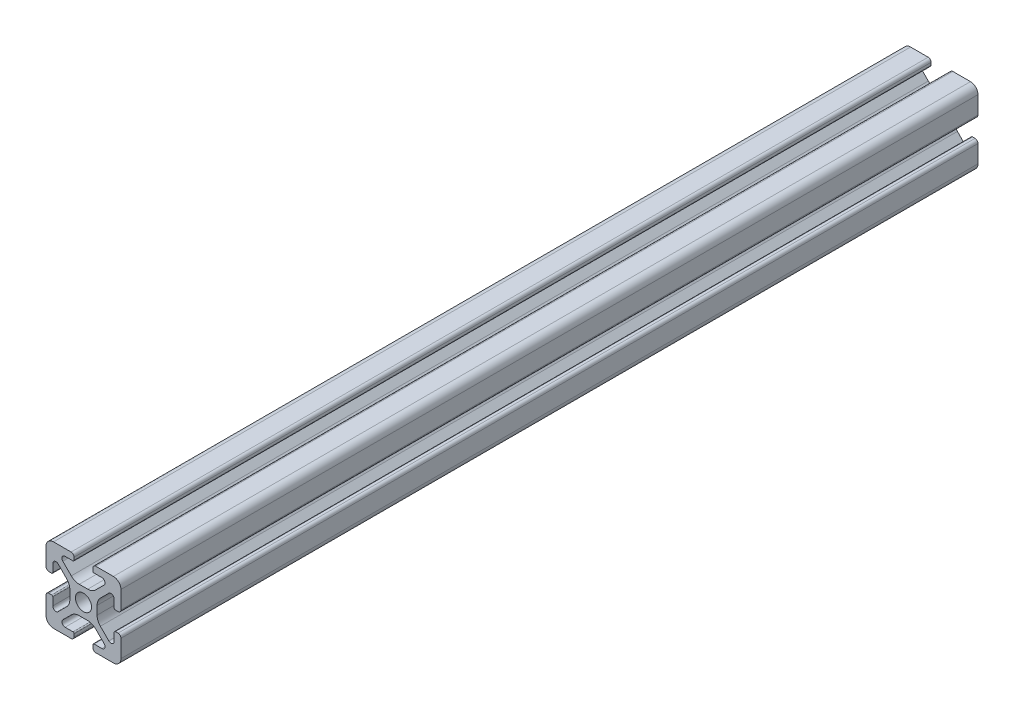
from build123d import *

# Parameters (mm, degrees)
SKETCH1_R           = 2.1463
BOSS_EXTRUDE1_DEPTH = 114.3


with BuildPart() as part:
    # Sketch1 → Boss-Extrude1 (new, symmetric)
    with BuildSketch(Plane.XY):
        with BuildLine():
            Line((-9.9949, 7.9883), (-9.9949, 3.2893))
            ThreePointArc((-9.9949, 3.2893), (-9.76427588, 2.73252412), (-9.2075, 2.5019))
            Line((-9.2075, 2.5019), (-8.4963, 2.5019))
            ThreePointArc((-8.4963, 2.5019), (-8.280773853, 2.591173853), (-8.1915, 2.8067))
            Line((-8.1915, 2.8067), (-8.1915, 4.9149))
            ThreePointArc((-8.1915, 4.9149), (-7.674065253, 5.689295824), (-6.760603096, 5.507596904))
            Line((-6.760603096, 5.507596904), (-4.505765747, 3.252759555))
            ThreePointArc((-4.505765747, 3.252759555), (-3.856054457, 2.280397894), (-3.627906192, 1.133419111))
            Line((-3.627906192, 1.133419111), (-3.627906192, -1.133419111))
            ThreePointArc((-3.627906192, -1.133419111), (-3.856054457, -2.280397894), (-4.505765747, -3.252759555))
            Line((-4.505765747, -3.252759555), (-6.760603096, -5.507596904))
            ThreePointArc((-6.760603096, -5.507596904), (-7.674065253, -5.689295824), (-8.1915, -4.9149))
            Line((-8.1915, -4.9149), (-8.1915, -2.8067))
            ThreePointArc((-8.1915, -2.8067), (-8.280773853, -2.591173853), (-8.4963, -2.5019))
            Line((-8.4963, -2.5019), (-9.2075, -2.5019))
            ThreePointArc((-9.2075, -2.5019), (-9.76427588, -2.73252412), (-9.9949, -3.2893))
            Line((-9.9949, -3.2893), (-9.9949, -7.9883))
            ThreePointArc((-9.9949, -7.9883), (-9.407180467, -9.407180467), (-7.9883, -9.9949))
            Line((-7.9883, -9.9949), (-3.2893, -9.9949))
            ThreePointArc((-3.2893, -9.9949), (-2.73252412, -9.76427588), (-2.5019, -9.2075))
            Line((-2.5019, -9.2075), (-2.5019, -8.4963))
            ThreePointArc((-2.5019, -8.4963), (-2.591173853, -8.280773853), (-2.8067, -8.1915))
            Line((-2.8067, -8.1915), (-4.9149, -8.1915))
            ThreePointArc((-4.9149, -8.1915), (-5.689295824, -7.674065253), (-5.507596904, -6.760603096))
            Line((-5.507596904, -6.760603096), (-3.252759555, -4.505765747))
            ThreePointArc((-3.252759555, -4.505765747), (-2.280397894, -3.856054457), (-1.133419111, -3.627906192))
            Line((-1.133419111, -3.627906192), (1.133419111, -3.627906192))
            ThreePointArc((1.133419111, -3.627906192), (2.280397894, -3.856054457), (3.252759555, -4.505765747))
            Line((3.252759555, -4.505765747), (5.507596904, -6.760603096))
            ThreePointArc((5.507596904, -6.760603096), (5.689295824, -7.674065253), (4.9149, -8.1915))
            Line((4.9149, -8.1915), (2.8067, -8.1915))
            ThreePointArc((2.8067, -8.1915), (2.591173853, -8.280773853), (2.5019, -8.4963))
            Line((2.5019, -8.4963), (2.5019, -9.2075))
            ThreePointArc((2.5019, -9.2075), (2.73252412, -9.76427588), (3.2893, -9.9949))
            Line((3.2893, -9.9949), (7.9883, -9.9949))
            ThreePointArc((7.9883, -9.9949), (9.407180467, -9.407180467), (9.9949, -7.9883))
            Line((9.9949, -7.9883), (9.9949, -3.2893))
            ThreePointArc((9.9949, -3.2893), (9.76427588, -2.73252412), (9.2075, -2.5019))
            Line((9.2075, -2.5019), (8.4963, -2.5019))
            ThreePointArc((8.4963, -2.5019), (8.280773853, -2.591173853), (8.1915, -2.8067))
            Line((8.1915, -2.8067), (8.1915, -4.9149))
            ThreePointArc((8.1915, -4.9149), (7.674065253, -5.689295824), (6.760603096, -5.507596904))
            Line((6.760603096, -5.507596904), (4.505765747, -3.252759555))
            ThreePointArc((4.505765747, -3.252759555), (3.856054457, -2.280397894), (3.627906192, -1.133419111))
            Line((3.627906192, -1.133419111), (3.627906192, 1.133419111))
            ThreePointArc((3.627906192, 1.133419111), (3.856054457, 2.280397894), (4.505765747, 3.252759555))
            Line((4.505765747, 3.252759555), (6.760603096, 5.507596904))
            ThreePointArc((6.760603096, 5.507596904), (7.674065253, 5.689295824), (8.1915, 4.9149))
            Line((8.1915, 4.9149), (8.1915, 2.8067))
            ThreePointArc((8.1915, 2.8067), (8.280773853, 2.591173853), (8.4963, 2.5019))
            Line((8.4963, 2.5019), (9.2075, 2.5019))
            ThreePointArc((9.2075, 2.5019), (9.76427588, 2.73252412), (9.9949, 3.2893))
            Line((9.9949, 3.2893), (9.9949, 7.9883))
            ThreePointArc((9.9949, 7.9883), (9.407180467, 9.407180467), (7.9883, 9.9949))
            Line((7.9883, 9.9949), (3.2893, 9.9949))
            ThreePointArc((3.2893, 9.9949), (2.73252412, 9.76427588), (2.5019, 9.2075))
            Line((2.5019, 9.2075), (2.5019, 8.4963))
            ThreePointArc((2.5019, 8.4963), (2.591173853, 8.280773853), (2.8067, 8.1915))
            Line((2.8067, 8.1915), (4.9149, 8.1915))
            ThreePointArc((4.9149, 8.1915), (5.689295824, 7.674065253), (5.507596904, 6.760603096))
            Line((5.507596904, 6.760603096), (3.252759555, 4.505765747))
            ThreePointArc((3.252759555, 4.505765747), (2.280397894, 3.856054457), (1.133419111, 3.627906192))
            Line((1.133419111, 3.627906192), (-1.133419111, 3.627906192))
            ThreePointArc((-1.133419111, 3.627906192), (-2.280397894, 3.856054457), (-3.252759555, 4.505765747))
            Line((-3.252759555, 4.505765747), (-5.507596904, 6.760603096))
            ThreePointArc((-5.507596904, 6.760603096), (-5.689295824, 7.674065253), (-4.9149, 8.1915))
            Line((-4.9149, 8.1915), (-2.8067, 8.1915))
            ThreePointArc((-2.8067, 8.1915), (-2.591173853, 8.280773853), (-2.5019, 8.4963))
            Line((-2.5019, 8.4963), (-2.5019, 9.2075))
            ThreePointArc((-2.5019, 9.2075), (-2.73252412, 9.76427588), (-3.2893, 9.9949))
            Line((-3.2893, 9.9949), (-7.9883, 9.9949))
            ThreePointArc((-7.9883, 9.9949), (-9.407180467, 9.407180467), (-9.9949, 7.9883))
        make_face()
        Circle(SKETCH1_R, mode=Mode.SUBTRACT)
    extrude(amount=BOSS_EXTRUDE1_DEPTH, both=True)


solid = part.part
